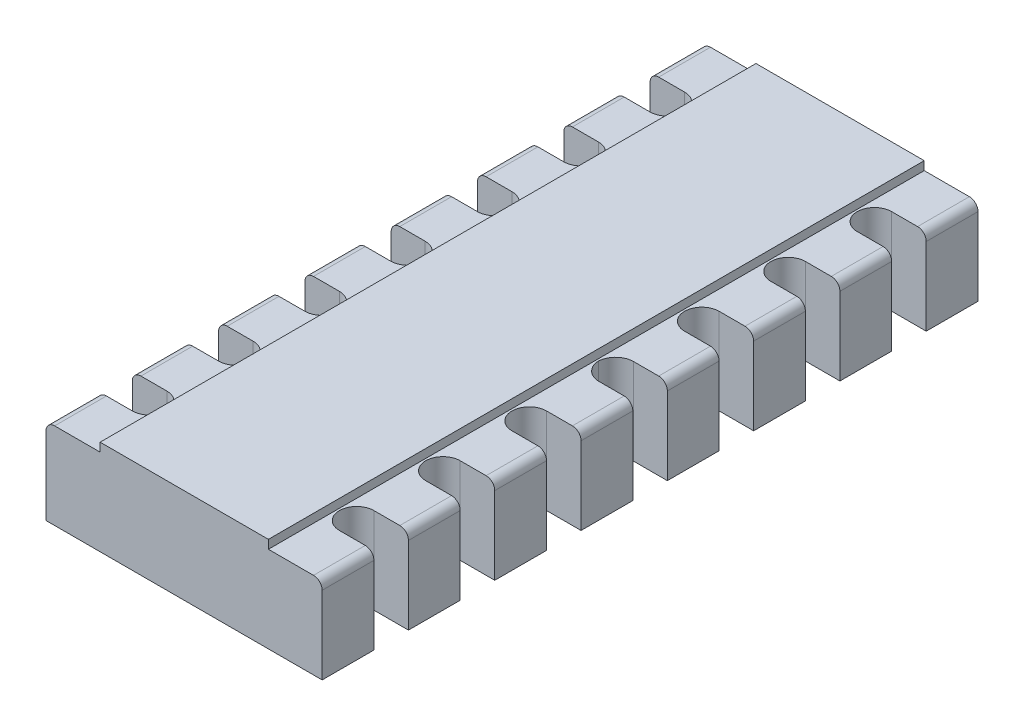
from build123d import *

# Parameters (mm, degrees)
BOSS_EXTRUDE1_DEPTH = 0.5
SKETCH2_W           = 0.974965632
SKETCH2_H           = 3.8
BOSS_EXTRUDE2_DEPTH = 0.05
FILLET2_R           = 0.05


with BuildPart() as part:
    # Sketch1 → Boss-Extrude1 (new body)
    with BuildSketch(Plane(origin=(0, 0, 0), x_dir=(1, 0, 0), z_dir=(0, 1, 0))):
        with BuildLine():
            Line((-0.8, 1.9), (-0.8, 1.6))
            Line((-0.8, 1.6), (-0.6, 1.6))
            ThreePointArc((-0.6, 1.6), (-0.5, 1.5), (-0.6, 1.4))
            Line((-0.6, 1.4), (-0.8, 1.4))
            Line((-0.8, 1.4), (-0.8, 1.1))
            Line((-0.8, 1.1), (-0.6, 1.1))
            ThreePointArc((-0.6, 1.1), (-0.5, 1), (-0.6, 0.9))
            Line((-0.6, 0.9), (-0.8, 0.9))
            Line((-0.8, 0.9), (-0.8, 0.6))
            Line((-0.8, 0.6), (-0.6, 0.6))
            ThreePointArc((-0.6, 0.6), (-0.5, 0.5), (-0.6, 0.4))
            Line((-0.6, 0.4), (-0.8, 0.4))
            Line((-0.8, 0.4), (-0.8, 0.1))
            Line((-0.8, 0.1), (-0.604637585, 0.1))
            ThreePointArc((-0.604637585, 0.1), (-0.532268697, 0.070979936), (-0.5, 0))
            ThreePointArc((-0.5, 0), (-0.532268697, -0.070979936), (-0.604637585, -0.1))
            Line((-0.604637585, -0.1), (-0.8, -0.1))
            Line((-0.8, -0.1), (-0.8, -0.4))
            Line((-0.8, -0.4), (-0.6, -0.4))
            ThreePointArc((-0.6, -0.4), (-0.5, -0.5), (-0.6, -0.6))
            Line((-0.6, -0.6), (-0.8, -0.6))
            Line((-0.8, -0.6), (-0.8, -0.9))
            Line((-0.8, -0.9), (-0.6, -0.9))
            ThreePointArc((-0.6, -0.9), (-0.5, -1), (-0.6, -1.1))
            Line((-0.6, -1.1), (-0.8, -1.1))
            Line((-0.8, -1.1), (-0.8, -1.4))
            Line((-0.8, -1.4), (-0.6, -1.4))
            ThreePointArc((-0.6, -1.4), (-0.5, -1.5), (-0.6, -1.6))
            Line((-0.6, -1.6), (-0.8, -1.6))
            Line((-0.8, -1.6), (-0.8, -1.9))
            Line((-0.8, -1.9), (0.8, -1.9))
            Line((0.8, -1.9), (0.8, -1.6))
            Line((0.8, -1.6), (0.6, -1.6))
            ThreePointArc((0.6, -1.6), (0.5, -1.5), (0.6, -1.4))
            Line((0.6, -1.4), (0.8, -1.4))
            Line((0.8, -1.4), (0.8, -1.1))
            Line((0.8, -1.1), (0.6, -1.1))
            ThreePointArc((0.6, -1.1), (0.5, -1), (0.6, -0.9))
            Line((0.6, -0.9), (0.8, -0.9))
            Line((0.8, -0.9), (0.8, -0.6))
            Line((0.8, -0.6), (0.6, -0.6))
            ThreePointArc((0.6, -0.6), (0.5, -0.5), (0.6, -0.4))
            Line((0.6, -0.4), (0.8, -0.4))
            Line((0.8, -0.4), (0.8, -0.1))
            Line((0.8, -0.1), (0.604637585, -0.1))
            ThreePointArc((0.604637585, -0.1), (0.532268697, -0.070979936), (0.5, 0))
            ThreePointArc((0.5, 0), (0.532268697, 0.070979936), (0.604637585, 0.1))
            Line((0.604637585, 0.1), (0.8, 0.1))
            Line((0.8, 0.1), (0.8, 0.4))
            Line((0.8, 0.4), (0.6, 0.4))
            ThreePointArc((0.6, 0.4), (0.5, 0.5), (0.6, 0.6))
            Line((0.6, 0.6), (0.8, 0.6))
            Line((0.8, 0.6), (0.8, 0.9))
            Line((0.8, 0.9), (0.6, 0.9))
            ThreePointArc((0.6, 0.9), (0.5, 1), (0.6, 1.1))
            Line((0.6, 1.1), (0.8, 1.1))
            Line((0.8, 1.1), (0.8, 1.4))
            Line((0.8, 1.4), (0.6, 1.4))
            ThreePointArc((0.6, 1.4), (0.5, 1.5), (0.6, 1.6))
            Line((0.6, 1.6), (0.8, 1.6))
            Line((0.8, 1.6), (0.8, 1.9))
            Line((0.8, 1.9), (-0.8, 1.9))
        make_face()
    extrude(amount=BOSS_EXTRUDE1_DEPTH)

    # Sketch2 → Boss-Extrude2 (add)
    with BuildSketch(Plane(origin=(0, 0.5, 0), x_dir=(1, 0, 0), z_dir=(0, 1, 0))):
        with Locations((0.001088626, 0)):
            Rectangle(SKETCH2_W, SKETCH2_H)
    extrude(amount=BOSS_EXTRUDE2_DEPTH)

    # Fillet2
    fillet2_edges = [part.edges().sort_by_distance(p)[0] for p in [
        (-0.8, 0.5, 1.25),
        (-0.8, 0.5, 1.75),
        (-0.8, 0.5, -1.75),
        (0.8, 0.5, 1.75),
        (0.8, 0.5, 1.25),
        (0.8, 0.5, 0.75),
        (0.8, 0.5, 0.25),
        (0.8, 0.5, -0.25),
        (0.8, 0.5, -0.75),
        (0.8, 0.5, -1.25),
        (-0.8, 0.5, -1.25),
        (-0.8, 0.5, -0.75),
        (0.8, 0.5, -1.75),
        (-0.8, 0.5, -0.25),
        (-0.8, 0.5, 0.25),
        (-0.8, 0.5, 0.75),
    ]]
    fillet(fillet2_edges, radius=FILLET2_R)


solid = part.part
